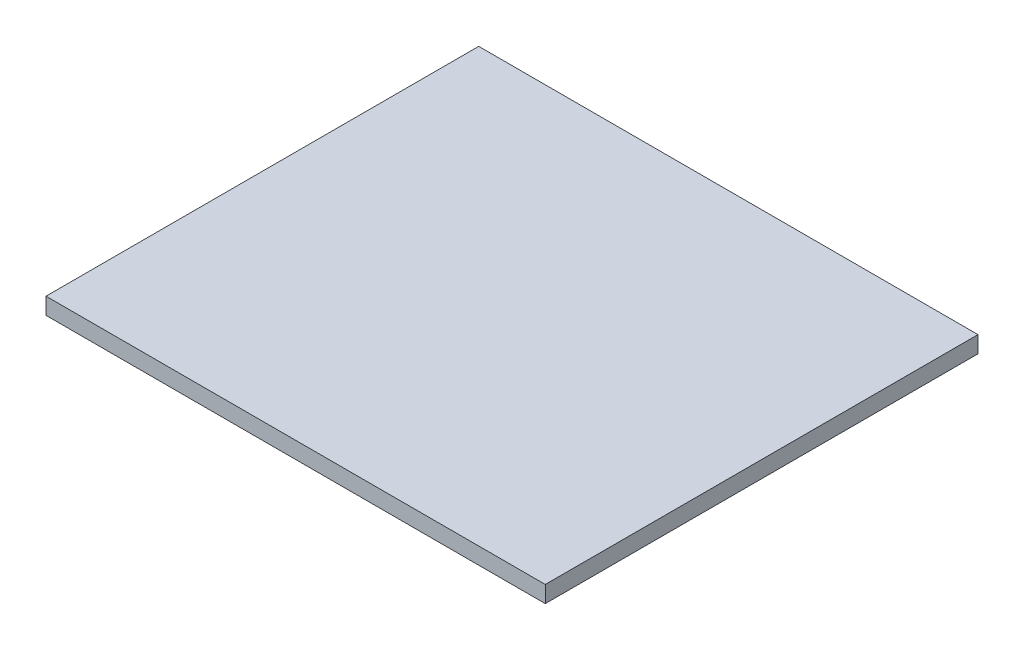
from build123d import *

# Parameters (mm, degrees)
SKETCH1_W           = 26
SKETCH1_H           = 1
BOSS_EXTRUDE1_DEPTH = 15


with BuildPart() as part:
    # Sketch1 → Boss-Extrude1 (new, symmetric)
    with BuildSketch(Plane(origin=(0, 0, 0), x_dir=(0, 0, -1), z_dir=(1, 0, 0))):
        with Locations((0.475767385, 0.8016658)):
            Rectangle(SKETCH1_W, SKETCH1_H)
    extrude(amount=BOSS_EXTRUDE1_DEPTH, both=True)


solid = part.part
